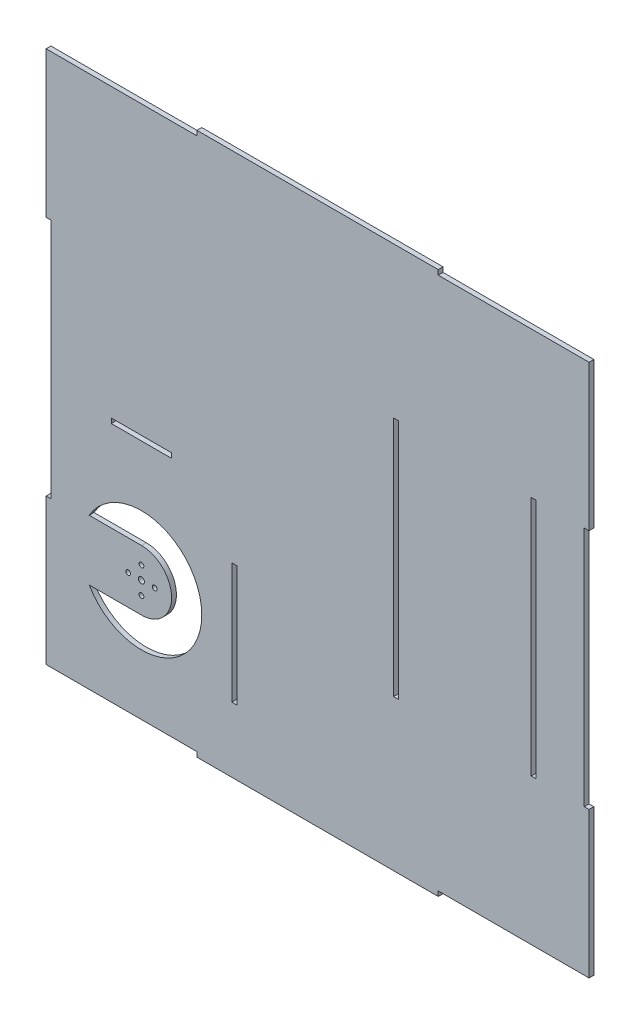
from build123d import *

# Parameters (mm, degrees)
SKETCH1_R           = 2
SKETCH1_R_2         = 2.5
SKETCH1_W           = 50
SKETCH1_H           = 4
SKETCH1_W_2         = 4
SKETCH1_H_2         = 100
SKETCH1_H_3         = 200
BOSS_EXTRUDE1_DEPTH = 4


with BuildPart() as part:
    # Sketch1 → Boss-Extrude1 (new body)
    with BuildSketch(Plane.XY):
        Polygon((-225.544562063, -221.45380172), (-100.544562063, -221.45380172), (-100.544562063, -225.45380172), (99.455437937, -225.45380172), (99.455437937, -221.45380172), (224.455437937, -221.45380172), (224.455437937, -100.45380172), (220.455437937, -100.45380172), (220.455437937, 99.54619828), (224.455437937, 99.54619828), (224.455437937, 220.54619828), (99.455437937, 220.54619828), (99.455437937, 224.54619828), (-100.544562063, 224.54619828), (-100.544562063, 220.54619828), (-225.544562063, 220.54619828), (-225.544562063, 99.54619828), (-221.544562063, 99.54619828), (-221.544562063, -100.45380172), (-225.544562063, -100.45380172), align=None)
        with Locations((-135.544562063, -121.45380172)):
            Circle(SKETCH1_R, mode=Mode.SUBTRACT)
        with Locations((-146.544562063, -110.45380172)):
            Circle(SKETCH1_R, mode=Mode.SUBTRACT)
        with Locations((-157.544562063, -121.45380172)):
            Circle(SKETCH1_R, mode=Mode.SUBTRACT)
        with Locations((-146.544562063, -132.45380172)):
            Circle(SKETCH1_R, mode=Mode.SUBTRACT)
        with Locations((-146.544562063, -121.45380172)):
            Circle(SKETCH1_R_2, mode=Mode.SUBTRACT)
        with BuildLine():
            Line((-146.544562063, -96.45380172), (-189.845832253, -96.45380172))
            ThreePointArc((-189.845832253, -96.45380172), (-96.544562063, -121.45380172), (-189.845832253, -146.45380172))
            Line((-189.845832253, -146.45380172), (-146.544562063, -146.45380172))
            ThreePointArc((-146.544562063, -146.45380172), (-121.544562063, -121.45380172), (-146.544562063, -96.45380172))
        make_face(mode=Mode.SUBTRACT)
        with Locations((-146.544562063, -19.45380172)):
            Rectangle(SKETCH1_W, SKETCH1_H, mode=Mode.SUBTRACT)
        with Locations((-69.544562063, -121.45380172)):
            Rectangle(SKETCH1_W_2, SKETCH1_H_2, mode=Mode.SUBTRACT)
        with Locations((64.455437937, -0.45380172)):
            Rectangle(SKETCH1_W_2, SKETCH1_H_3, mode=Mode.SUBTRACT)
        with Locations((178.455437937, -0.45380172)):
            Rectangle(SKETCH1_W_2, SKETCH1_H_3, mode=Mode.SUBTRACT)
    extrude(amount=BOSS_EXTRUDE1_DEPTH)


solid = part.part
